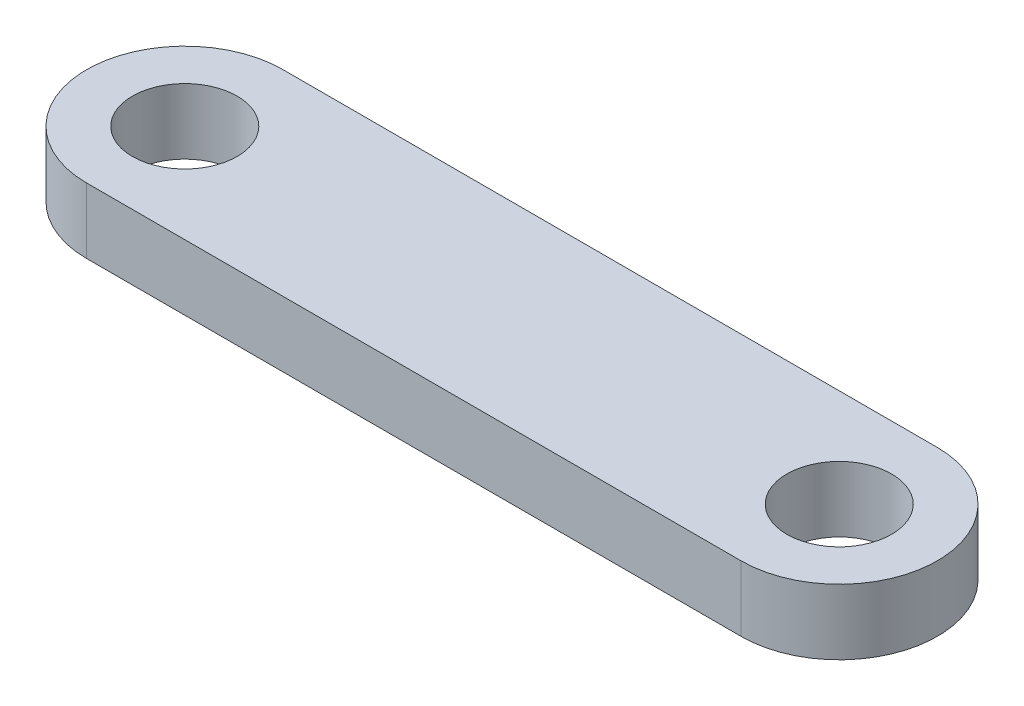
from build123d import *

# Parameters (mm, degrees)
SKETCH1_R           = 4
BOSS_EXTRUDE1_DEPTH = 5


with BuildPart() as part:
    # Sketch1 → Boss-Extrude1 (new body)
    with BuildSketch(Plane(origin=(0, 0, 0), x_dir=(1, 0, 0), z_dir=(0, 1, 0))):
        with BuildLine():
            Line((-25, 7.5), (25, 7.5))
            ThreePointArc((25, 7.5), (32.5, 0), (25, -7.5))
            Line((25, -7.5), (-25, -7.5))
            ThreePointArc((-25, -7.5), (-32.5, 0), (-25, 7.5))
        make_face()
        with Locations(Location((-25, 0, 0), (0, 0, 270))):
            Circle(SKETCH1_R, mode=Mode.SUBTRACT)
        with Locations(Location((25, 0, 0), (0, 0, 270))):
            Circle(SKETCH1_R, mode=Mode.SUBTRACT)
    extrude(amount=BOSS_EXTRUDE1_DEPTH)


solid = part.part
